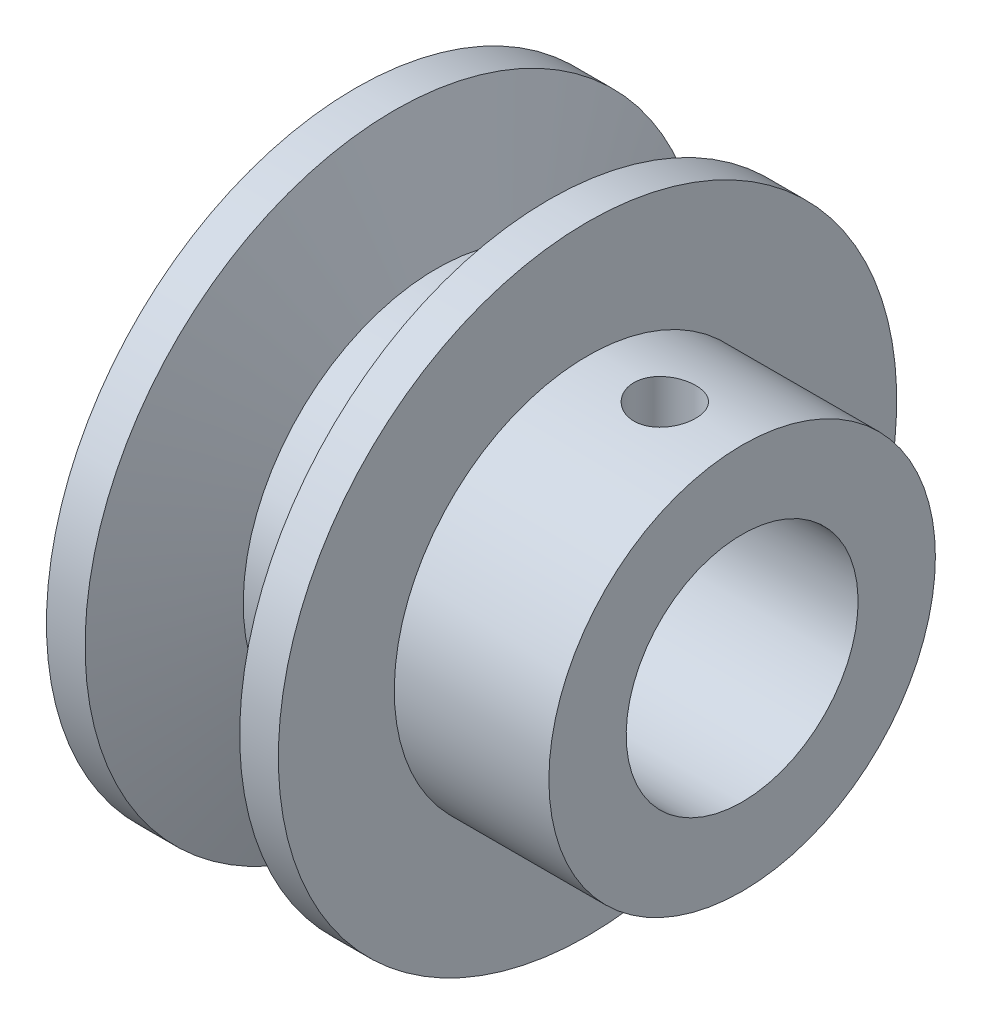
from build123d import *

# Parameters (mm, degrees)
SKETCH2_R               = 12.5
CUT_EXTRUDE1_DEPTH      = 65.031242374
BOSS_EXTRUDE1_START     = 20
SKETCH3_R               = 25
BOSS_EXTRUDE1_DEPTH     = 20
SKETCH2_2_R             = 12.5
CUT_EXTRUDE2_DEPTH      = 76.498344353
SKETCH5_R               = 20
CUT_EXTRUDE3_DEPTH      = 5
CUT_EXTRUDE3_DRAFT      = -45
SKETCH6_R               = 15
CUT_EXTRUDE4_DEPTH      = 73.284161474
CUT_EXTRUDE5_REACH      = 93.241
CUT_EXTRUDE5_END_RADIUS = 15
SKETCH10_R              = 4


with BuildPart() as part:
    # Sketch1 → Revolve1 (revolve)
    with BuildSketch(Plane.XY, mode=Mode.PRIVATE) as revolve1_sk:
        Polygon((0, 0), (0, 40), (5, 40), (10.459553514, 25), (19.540446486, 25), (25, 40), (30, 40), (30, 0), align=None)
    revolve(revolve1_sk.sketch.rotate(Axis((0, 0, 0), (1, 0, 0)), 180), axis=Axis((0, 0, 0), (1, 0, 0)))

    # Sketch2 → Cut-Extrude1 (cut, through all)
    with BuildSketch(Plane.ZY):
        with Locations(Location((0, 0, 0), (0, 0, 270))):
            Circle(SKETCH2_R)
    extrude(amount=-CUT_EXTRUDE1_DEPTH, mode=Mode.SUBTRACT)

    # Sketch3 → Boss-Extrude1 (add)
    with BuildSketch(Plane(origin=(30, 0, 0), x_dir=(0, 0, -1), z_dir=(1, 0, 0)).offset(BOSS_EXTRUDE1_START)):
        with Locations(Location((0, 0, 0), (0, 0, 270))):
            Circle(SKETCH3_R)
    extrude(amount=-BOSS_EXTRUDE1_DEPTH)

    # Sketch2<2> → Cut-Extrude2 (cut, through all)
    with BuildSketch(Plane.ZY):
        with Locations(Location((0, 0, 0), (0, 0, 270))):
            Circle(SKETCH2_2_R)
    extrude(amount=-CUT_EXTRUDE2_DEPTH, mode=Mode.SUBTRACT)


with BuildPart() as cut_extrude3_tool:
    # Sketch5 → Cut-Extrude3 (with draft: the straight prism first)
    with BuildSketch(Plane.ZY):
        Circle(SKETCH5_R)
    extrude(amount=-CUT_EXTRUDE3_DEPTH)
    # Cut-Extrude3: the draft: its side faces are tilted about the plane it starts from
    cut_extrude3_sides = [cut_extrude3_tool.faces().sort_by_distance(p)[0] for p in [
        (2.5, 0, -20),
    ]]
    draft(cut_extrude3_sides, Plane.ZY, CUT_EXTRUDE3_DRAFT)


with BuildPart() as part_1:
    add(part.part)

    # Cut-Extrude3: cut by cut_extrude3_tool
    add(cut_extrude3_tool.part, mode=Mode.SUBTRACT)

    # Sketch6 → Cut-Extrude4 (cut, through all)
    with BuildSketch(Plane.ZY.offset(-5)):
        with Locations(Location((0, 0, 0), (0, 0, 270))):
            Circle(SKETCH6_R)
    extrude(amount=-CUT_EXTRUDE4_DEPTH, mode=Mode.SUBTRACT)

    # Cut-Extrude5: up to this cylinder (the profile starts outside it)
    cut_extrude5_end = Plane(origin=(40, 0, 0), z_dir=(-1, 0, 0)) * Cylinder(CUT_EXTRUDE5_END_RADIUS, 217.482, mode=Mode.PRIVATE)
    # Sketch10 → Cut-Extrude5 (cut, up to the surface)
    with BuildSketch(Plane(origin=(0, 25, 0), x_dir=(1, 0, 0), z_dir=(0, 1, 0)), mode=Mode.PRIVATE) as cut_extrude5_sk1:
        with Locations(Location((40, 0, 0), (0, 0, 270))):
            Circle(SKETCH10_R)
    cut_extrude5_tool1 = extrude(cut_extrude5_sk1.sketch, amount=-CUT_EXTRUDE5_REACH, mode=Mode.PRIVATE) - cut_extrude5_end
    add(cut_extrude5_tool1.solids().sort_by_distance((40, 25, 0))[0], mode=Mode.SUBTRACT)


solid = part_1.part
